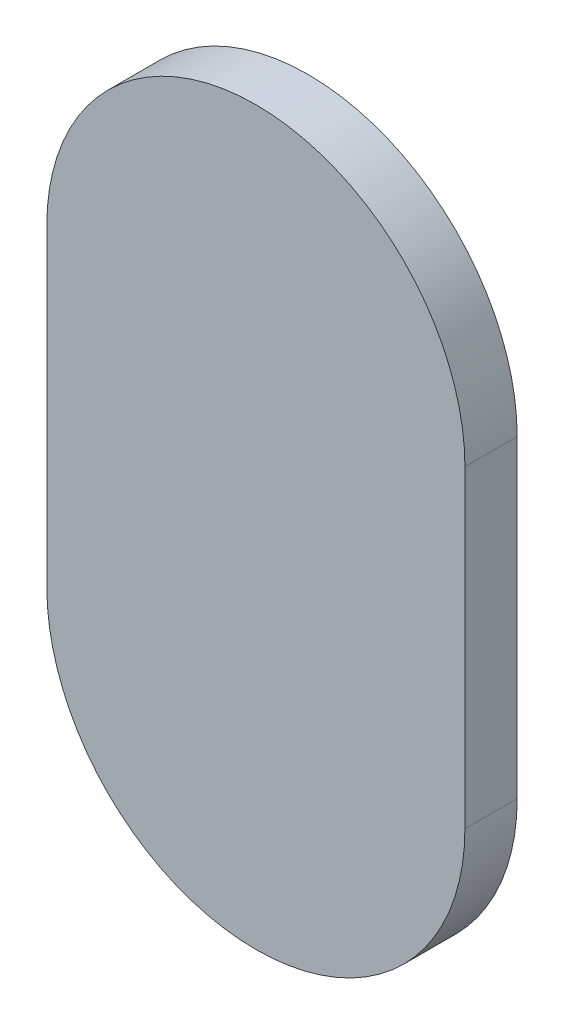
from build123d import *

# Parameters (mm, degrees)
BOSS_EXTRUDE1_DEPTH = 0.5


with BuildPart() as part:
    # Sketch1 → Boss-Extrude1 (new body)
    with BuildSketch(Plane.XY):
        with BuildLine():
            Line((2, 0), (2, -3))
            ThreePointArc((2, -3), (0, -5), (-2, -3))
            Line((-2, -3), (-2, 0))
            ThreePointArc((-2, 0), (0, 2), (2, 0))
        make_face()
    extrude(amount=BOSS_EXTRUDE1_DEPTH)


solid = part.part
